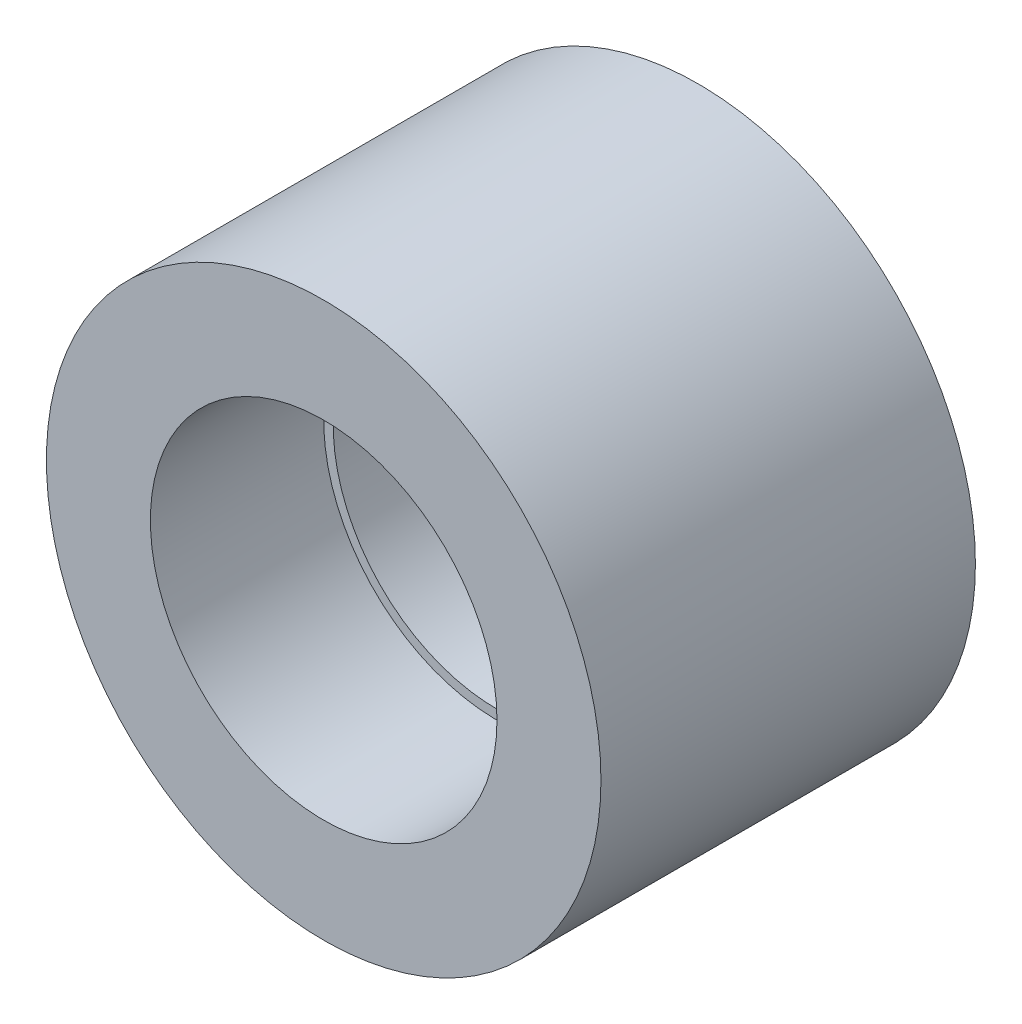
from build123d import *

# Parameters (mm, degrees)
SKETCH1_R           = 5.08
SKETCH1_R_2         = 3.175
BOSS_EXTRUDE1_DEPTH = 3.175
BOSS_EXTRUDE2_START = -3.68554
SKETCH1_3_R         = 5.08
SKETCH1_3_R_2       = 3.175
SKETCH1_3_R_3       = 3
BOSS_EXTRUDE2_DEPTH = 3.68554


with BuildPart() as part:
    # Sketch1 → Boss-Extrude1 (new body)
    with BuildSketch(Plane.XY):
        Circle(SKETCH1_R)
        Circle(SKETCH1_R_2, mode=Mode.SUBTRACT)
    extrude(amount=BOSS_EXTRUDE1_DEPTH)

    # Sketch1<3> → Boss-Extrude2 (add)
    # profile 1 of 2: a face of its own
    with BuildSketch(Plane.XY.offset(BOSS_EXTRUDE2_START)):
        Circle(SKETCH1_3_R)
        Circle(SKETCH1_3_R_2, mode=Mode.SUBTRACT)
    # profile 2 of 2: a face of its own
    with BuildSketch(Plane.XY.offset(BOSS_EXTRUDE2_START)):
        Circle(SKETCH1_3_R_2)
        Circle(SKETCH1_3_R_3, mode=Mode.SUBTRACT)
    extrude(amount=BOSS_EXTRUDE2_DEPTH)


solid = part.part
